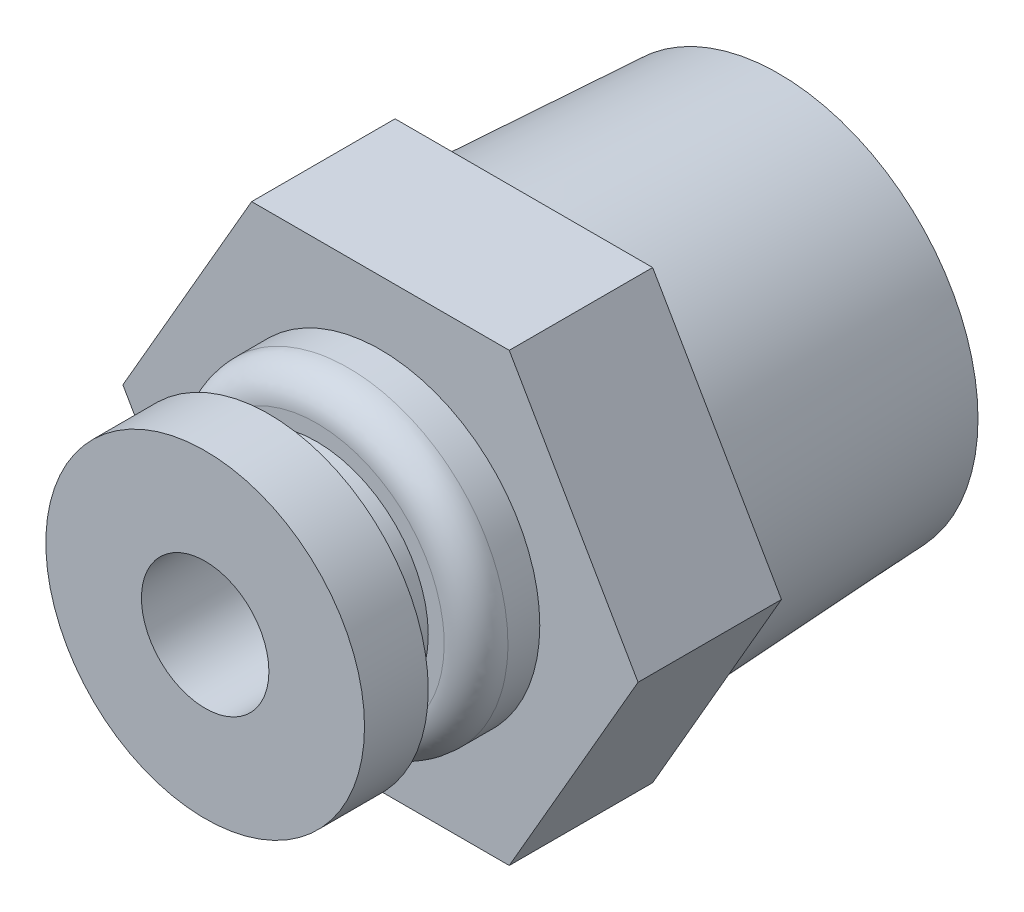
from build123d import *

# Parameters (mm, degrees)
SKETCH1_R           = 6.25
BOSS_EXTRUDE1_DEPTH = 8
BOSS_EXTRUDE1_DRAFT = -3
BOSS_EXTRUDE2_DEPTH = 4.5
SKETCH3_R           = 5
BOSS_EXTRUDE3_DEPTH = 2
SKETCH9_R           = 3.5
BOSS_EXTRUDE6_DEPTH = 0.5
FILLET1_R           = 1
SKETCH4_R           = 3
BOSS_EXTRUDE4_DEPTH = 1
SKETCH5_R           = 5
BOSS_EXTRUDE5_DEPTH = 2
SKETCH6_R           = 2
CUT_EXTRUDE1_DEPTH  = 9.5
CUT_EXTRUDE2_DEPTH  = 6.5
SKETCH8_R           = 4.5
CUT_EXTRUDE3_DEPTH  = 2


with BuildPart() as part:
    # Sketch1 → Boss-Extrude1 (with draft: the straight prism first)
    with BuildSketch(Plane.XY):
        Circle(SKETCH1_R)
    extrude(amount=BOSS_EXTRUDE1_DEPTH)
    # Boss-Extrude1: the draft: its side faces are tilted about the plane it starts from
    boss_extrude1_sides = [part.faces().sort_by_distance(p)[0] for p in [
        (-6.25, 0, 4),
    ]]
    draft(boss_extrude1_sides, Plane.XY, BOSS_EXTRUDE1_DRAFT)

    # Sketch2 → Boss-Extrude2 (add)
    with BuildSketch(Plane.XY.offset(8)):
        Polygon((8.082903769, 0), (4.041451884, 7), (-4.041451884, 7), (-8.082903769, 0), (-4.041451884, -7), (4.041451884, -7), align=None)
    extrude(amount=BOSS_EXTRUDE2_DEPTH)

    # Sketch3 → Boss-Extrude3 (add)
    with BuildSketch(Plane.XY.offset(12.5)):
        Circle(SKETCH3_R)
    extrude(amount=BOSS_EXTRUDE3_DEPTH)

    # Sketch9 → Boss-Extrude6 (add)
    with BuildSketch(Plane.XY.offset(14.5)):
        Circle(SKETCH9_R)
    extrude(amount=BOSS_EXTRUDE6_DEPTH)

    # Fillet1
    fillet1_edges = [part.edges().sort_by_distance(p)[0] for p in [
        (-5, 0, 14.5),
    ]]
    fillet(fillet1_edges, radius=FILLET1_R)

    # Sketch4 → Boss-Extrude4 (add)
    with BuildSketch(Plane.XY.offset(15)):
        Circle(SKETCH4_R)
    extrude(amount=BOSS_EXTRUDE4_DEPTH)

    # Sketch5 → Boss-Extrude5 (add)
    with BuildSketch(Plane.XY.offset(16)):
        Circle(SKETCH5_R)
    extrude(amount=BOSS_EXTRUDE5_DEPTH)

    # Sketch6 → Cut-Extrude1 (cut)
    with BuildSketch(Plane.XY.offset(18)):
        Circle(SKETCH6_R)
    extrude(amount=-CUT_EXTRUDE1_DEPTH, mode=Mode.SUBTRACT)

    # Sketch7 → Cut-Extrude2 (cut)
    with BuildSketch(Plane.XY.offset(8.5)):
        Polygon((0, -1.732050808), (1.5, -0.866025404), (1.5, 0.866025404), (0, 1.732050808), (-1.5, 0.866025404), (-1.5, -0.866025404), align=None)
    extrude(amount=-CUT_EXTRUDE2_DEPTH, mode=Mode.SUBTRACT)

    # Sketch8 → Cut-Extrude3 (cut)
    with BuildSketch(Plane(origin=(0, 0, 0), x_dir=(-1, 0, 0), z_dir=(0, 0, -1))):
        Circle(SKETCH8_R)
    extrude(amount=-CUT_EXTRUDE3_DEPTH, mode=Mode.SUBTRACT)


solid = part.part
